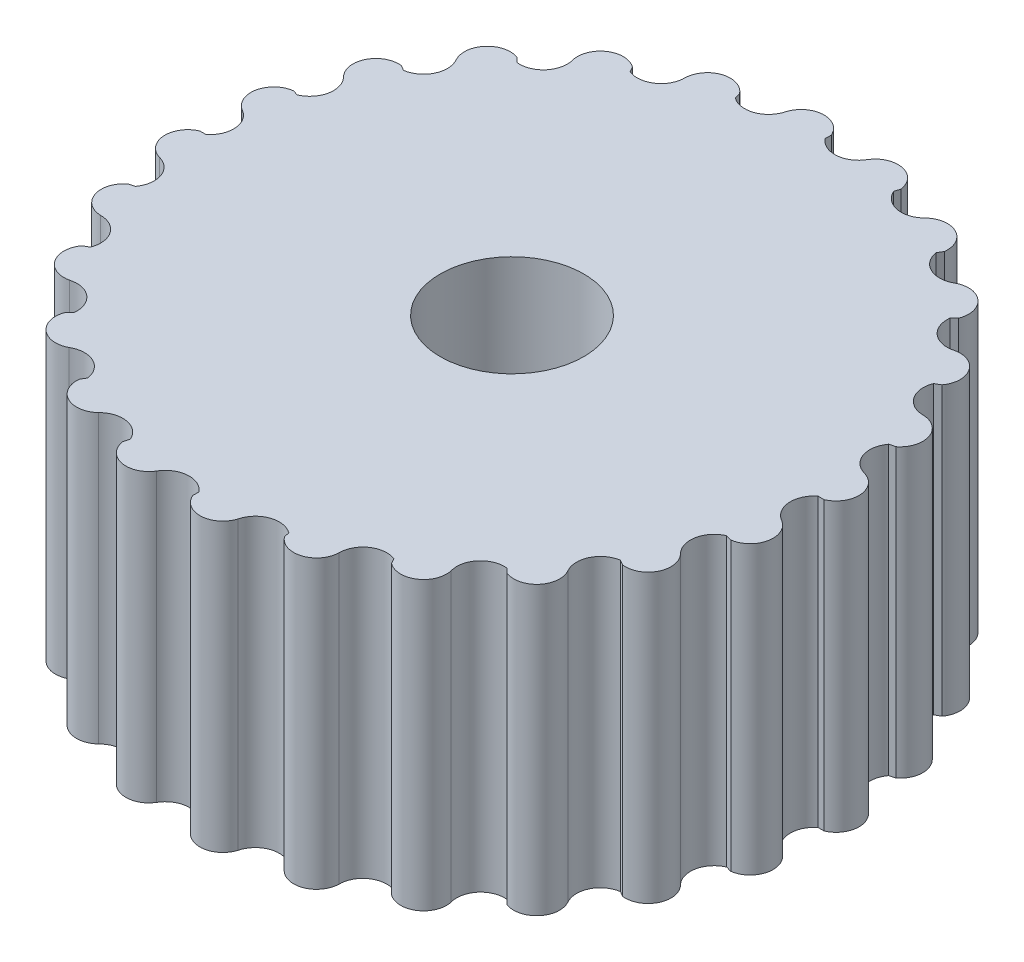
from build123d import *

# Parameters (mm, degrees)
BOSS_EXTRUDE1_DEPTH = 20
CIRPATTERN1_COUNT   = 24


with BuildPart() as part:
    # Sketch1 → Boss-Extrude1 (new body)
    with BuildSketch(Plane(origin=(0, 0, 0), x_dir=(1, 0, 0), z_dir=(0, 1, 0))):
        with BuildLine():
            Line((0, 22), (0, 5))
            ThreePointArc((0, 5), (0.680833245, 4.95342973), (1.348983856, 4.814586437))
            Line((1.348983856, 4.814586437), (5.935528965, 21.184180322))
            ThreePointArc((5.935528965, 21.184180322), (4.6794883, 22.518934017), (2.99566628, 21.795090813))
            ThreePointArc((2.99566628, 21.795090813), (1.433090681, 20.951044153), (0, 22))
        make_face()
    boss_extrude1 = extrude(amount=BOSS_EXTRUDE1_DEPTH)

    # CirPattern1: Boss-Extrude1 ×24 about axis
    cirpattern1_axis = Axis((0, 0, 0), (0, 1, 0))
    for i in range(1, CIRPATTERN1_COUNT):
        add(boss_extrude1.rotate(cirpattern1_axis, i * 360 / CIRPATTERN1_COUNT))


solid = part.part
